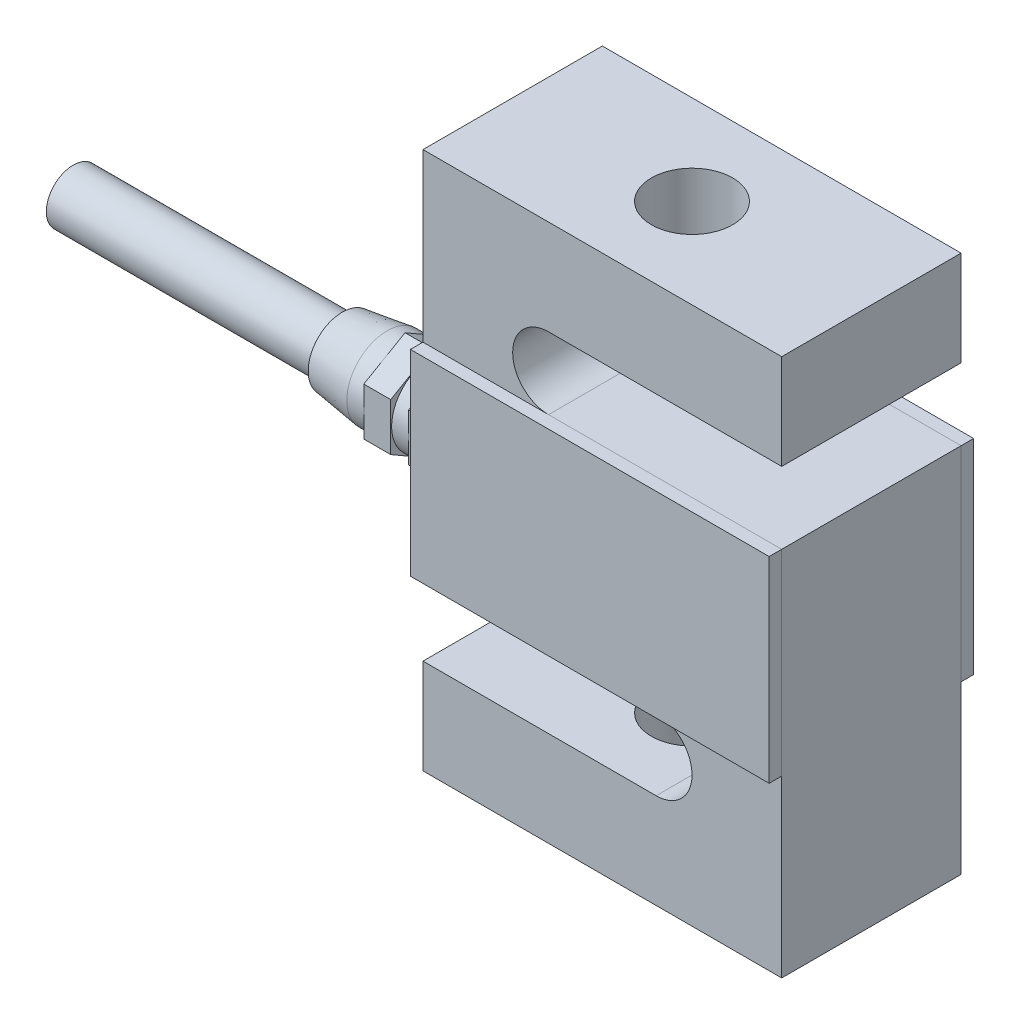
from build123d import *

# Parameters (mm, degrees)
EXTRUDE1_DEPTH              = 12.7
F_1_2_20_TAPPED_HOLE1_D     = 11.50874
F_1_2_20_TAPPED_HOLE1_DEPTH = 13.462
SKETCH5_W                   = 50.8
SKETCH5_H                   = 27.813
EXTRUDE5_DEPTH              = 1.778
SKETCH7_W                   = 50.8
SKETCH7_H                   = 28.956
EXTRUDE6_DEPTH              = 1.778
BOSS_EXTRUDE1_DEPTH         = 10.16
SKETCH11_R                  = 6.745760545
SKETCH11_R_2                = 5.715
CUT_EXTRUDE1_DEPTH          = 2.54


with BuildPart() as part:
    # Sketch1 → Extrude1 (new, symmetric)
    with BuildSketch(Plane.XY):
        with BuildLine():
            Line((-25.4, -38.1), (25.4, -38.1))
            Line((25.4, -38.1), (25.4, 14.478))
            Line((25.4, 14.478), (-7.62, 14.478))
            ThreePointArc((-7.62, 14.478), (-12.7, 19.558), (-7.62, 24.638))
            Line((-7.62, 24.638), (25.4, 24.638))
            Line((25.4, 24.638), (25.4, 38.1))
            Line((25.4, 38.1), (-25.4, 38.1))
            Line((-25.4, 38.1), (-25.4, -14.478))
            Line((-25.4, -14.478), (7.62, -14.478))
            ThreePointArc((7.62, -14.478), (12.7, -19.558), (7.62, -24.638))
            Line((7.62, -24.638), (-25.4, -24.638))
            Line((-25.4, -24.638), (-25.4, -38.1))
        make_face()
    extrude(amount=EXTRUDE1_DEPTH, both=True)

    # 1/2-20 Tapped Hole1
    with Locations(Plane(origin=(0, 38.1, 0), x_dir=(1, 0, 0), z_dir=(0, 1, 0))):
        with Locations((0, 0)):
            f_1_2_20_tapped_hole1 = Hole(F_1_2_20_TAPPED_HOLE1_D / 2, depth=F_1_2_20_TAPPED_HOLE1_DEPTH)

    # Mirror1: 1/2-20 Tapped Hole1 across plane
    add(f_1_2_20_tapped_hole1.mirror(Plane.ZX), mode=Mode.SUBTRACT)

    # Sketch10 → Boss-Extrude1 (add)
    with BuildSketch(Plane.ZY.offset(25.4)):
        Polygon((5.08, 6.745760545), (-0.762, 3.372880273), (-0.762, -3.372880273), (5.08, -6.745760545), (10.922, -3.372880273), (10.922, 3.372880273), align=None)
    extrude(amount=BOSS_EXTRUDE1_DEPTH)

    # Sketch11 → Cut-Extrude1 (cut)
    with BuildSketch(Plane.ZY.offset(29.21)):
        with Locations((5.08, 0)):
            Circle(SKETCH11_R)
        with Locations((5.08, 0)):
            Circle(SKETCH11_R_2, mode=Mode.SUBTRACT)
    extrude(amount=CUT_EXTRUDE1_DEPTH, mode=Mode.SUBTRACT)

    # Sketch12 → Revolve1 (revolve)
    with BuildSketch(Plane(origin=(0, 0, 0), x_dir=(1, 0, 0), z_dir=(0, 1, 0))):
        Polygon((-44.45, -0.254), (-44.45, -1.27), (-82.55, -1.27), (-82.55, -5.08), (-35.56, -5.08), (-35.56, 0.635), (-38.1, 0.635), align=None)
    revolve(axis=Axis((-35.56, 0, 5.08), (-1, 0, 0)))


with BuildPart() as body_2:
    # Sketch5 → Extrude5 (new body)
    with BuildSketch(Plane.XY.offset(12.7)):
        with Locations((0, 0.5715)):
            Rectangle(SKETCH5_W, SKETCH5_H)
    extrude(amount=EXTRUDE5_DEPTH)


with BuildPart() as body_3:
    # Sketch7 → Extrude6 (new body)
    with BuildSketch(Plane(origin=(0, 0, -12.7), x_dir=(-1, 0, 0), z_dir=(0, 0, -1))):
        Rectangle(SKETCH7_W, SKETCH7_H)
    extrude(amount=EXTRUDE6_DEPTH)


solid = Compound([part.part, body_2.part, body_3.part])
